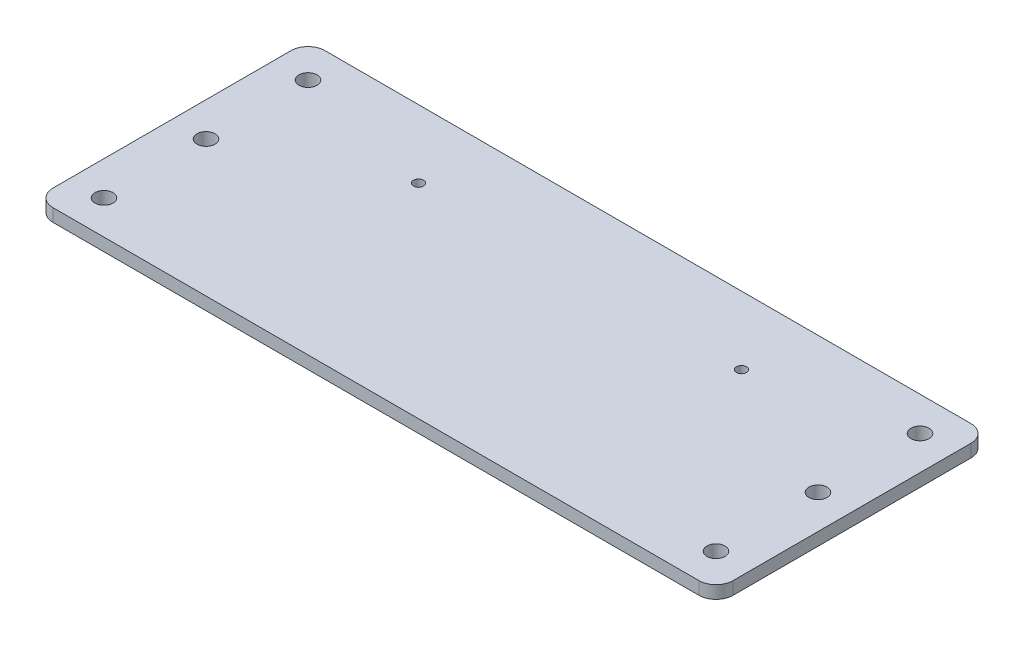
from build123d import *

# Parameters (mm, degrees)
SKETCH2_W               = 254
SKETCH2_H               = 101.6
BOSS_EXTRUDE1_DEPTH     = 4.7625
FILLET1_R               = 6.35
F_6_CLEARANCE_HOLE1_D   = 3.7973
F_1_4_CLEARANCE_HOLE1_D = 6.7564


with BuildPart() as part:
    # Sketch2 → Boss-Extrude1 (new body)
    with BuildSketch(Plane(origin=(0, 0, 0), x_dir=(1, 0, 0), z_dir=(0, 1, 0))):
        with Locations((127, -50.8)):
            Rectangle(SKETCH2_W, SKETCH2_H)
    extrude(amount=BOSS_EXTRUDE1_DEPTH)

    # Fillet1
    fillet1_edges = [part.edges().sort_by_distance(p)[0] for p in [
        (0, 2.38125, 0),
        (254, 2.38125, 0),
        (254, 2.38125, 101.6),
        (0, 2.38125, 101.6),
    ]]
    fillet(fillet1_edges, radius=FILLET1_R)

    # #6 Clearance Hole1 (through all)
    with Locations(Plane(origin=(0, 4.7625, 0), x_dir=(1, 0, 0), z_dir=(0, 1, 0))):
        with Locations((66.675, -25.4), (187.325, -25.4)):
            Hole(F_6_CLEARANCE_HOLE1_D / 2)

    # 1/4 Clearance Hole1 (through all)
    with Locations(Plane(origin=(0, 4.7625, 0), x_dir=(1, 0, 0), z_dir=(0, 1, 0))):
        with Locations((12.7, -12.7), (12.7, -88.9), (241.3, -88.9), (241.3, -12.7), (12.7, -50.8), (241.3, -50.8)):
            Hole(F_1_4_CLEARANCE_HOLE1_D / 2)


solid = part.part
